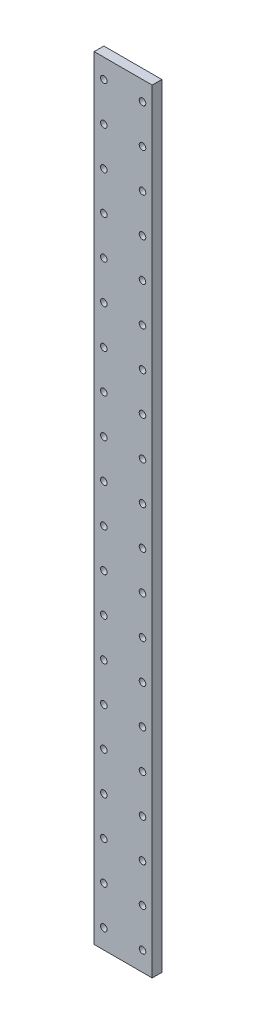
from build123d import *

# Parameters (mm, degrees)
SKETCH1_W             = 38.1
SKETCH1_H             = 508
BOSS_EXTRUDE1_DEPTH   = 3.175
F_8_CLEARANCE_HOLE1_D = 4.3053


with BuildPart() as part:
    # Sketch1 → Boss-Extrude1 (new, symmetric)
    with BuildSketch(Plane.XY):
        Rectangle(SKETCH1_W, SKETCH1_H)
    extrude(amount=BOSS_EXTRUDE1_DEPTH, both=True)

    # #8 Clearance Hole1 (through all)
    with Locations(Plane.XY.offset(3.175)):
        with Locations((-12.7, -241.3), (12.7, -241.3), (-12.7, -215.9), (12.7, -215.9), (-12.7, -190.5), (12.7, -190.5), (-12.7, -165.1), (12.7, -165.1), (-12.7, -139.7), (12.7, -139.7), (-12.7, -114.3), (12.7, -114.3), (-12.7, -88.9), (12.7, -88.9), (-12.7, -63.5), (12.7, -63.5), (-12.7, -38.1), (12.7, -38.1), (-12.7, -12.7), (12.7, -12.7), (-12.7, 12.7), (12.7, 12.7), (-12.7, 38.1), (12.7, 38.1), (-12.7, 63.5), (12.7, 63.5), (-12.7, 88.9), (12.7, 88.9), (-12.7, 114.3), (12.7, 114.3), (-12.7, 139.7), (12.7, 139.7), (-12.7, 165.1), (12.7, 165.1), (-12.7, 190.5), (12.7, 190.5), (-12.7, 215.9), (12.7, 215.9), (-12.7, 241.3), (12.7, 241.3)):
            Hole(F_8_CLEARANCE_HOLE1_D / 2)


solid = part.part
